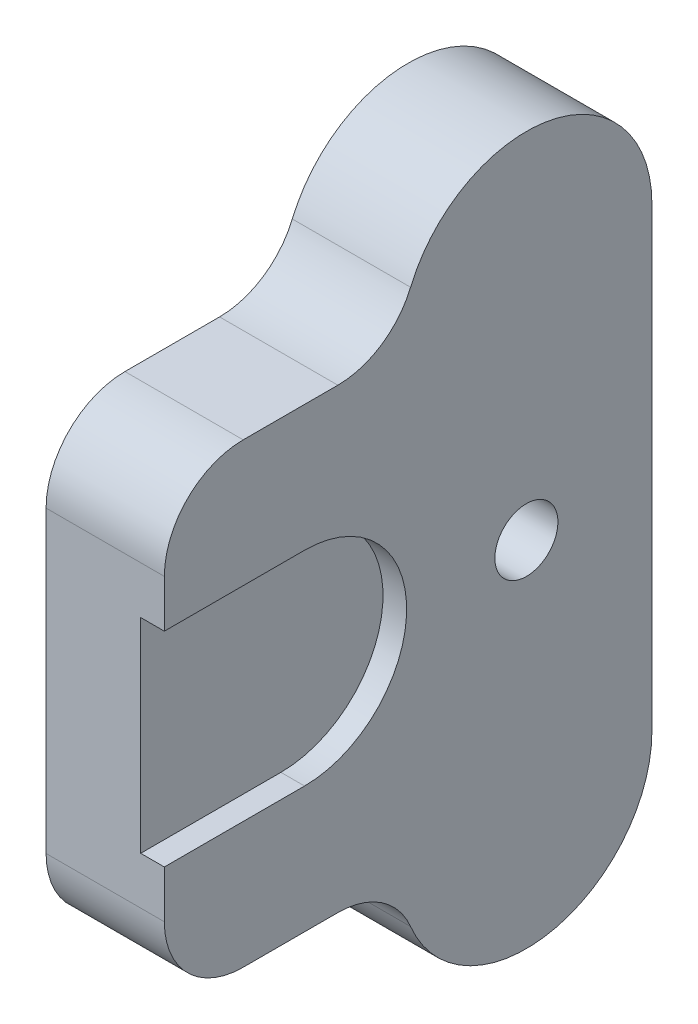
from build123d import *

# Parameters (mm, degrees)
BOSS_EXTRUDE3_DEPTH = 15
SKETCH3_R           = 4
CUT_EXTRUDE3_DEPTH  = 14.0462
CUT_EXTRUDE4_DEPTH  = 3


with BuildPart() as part:
    # Sketch1 → Boss-Extrude3 (new body)
    with BuildSketch(Plane.YZ):
        with BuildLine():
            Line((-28.968617751, -12.789334175), (28.968617751, -12.789334175))
            ThreePointArc((28.968617751, -12.789334175), (44.579120821, 0), (35.110840206, 17.821518929))
            ThreePointArc((35.110840206, 17.821518929), (30.644623053, 21.505675602), (28.968617751, 27.047436358))
            Line((28.968617751, 27.047436358), (28.968617751, 39.053986921))
            ThreePointArc((28.968617751, 39.053986921), (26.039685563, 46.125054733), (18.968617751, 49.053986921))
            Line((18.968617751, 49.053986921), (-18.968617751, 49.053986921))
            ThreePointArc((-18.968617751, 49.053986921), (-26.039685563, 46.125054733), (-28.968617751, 39.053986921))
            Line((-28.968617751, 39.053986921), (-28.968617751, 27.047436358))
            ThreePointArc((-28.968617751, 27.047436358), (-30.644623053, 21.505675602), (-35.110840206, 17.821518929))
            ThreePointArc((-35.110840206, 17.821518929), (-44.579120821, 0), (-28.968617751, -12.789334175))
        make_face()
    extrude(amount=BOSS_EXTRUDE3_DEPTH)

    # Sketch3 → Cut-Extrude3 (cut)
    with BuildSketch(Plane.YZ.offset(15)):
        with Locations(Location((0, 3.132326373, 0), (0, 0, 270))):
            Circle(SKETCH3_R)
    extrude(amount=-CUT_EXTRUDE3_DEPTH, mode=Mode.SUBTRACT)

    # Sketch4 → Cut-Extrude4 (cut)
    with BuildSketch(Plane.YZ.offset(15)):
        with BuildLine():
            Line((-12.95, 49.053986921), (-12.95, 31.267703884))
            ThreePointArc((-12.95, 31.267703884), (0, 18.317703884), (12.95, 31.267703884))
            Line((12.95, 31.267703884), (12.95, 49.053986921))
            Line((12.95, 49.053986921), (-12.95, 49.053986921))
        make_face()
    extrude(amount=-CUT_EXTRUDE4_DEPTH, mode=Mode.SUBTRACT)


solid = part.part
